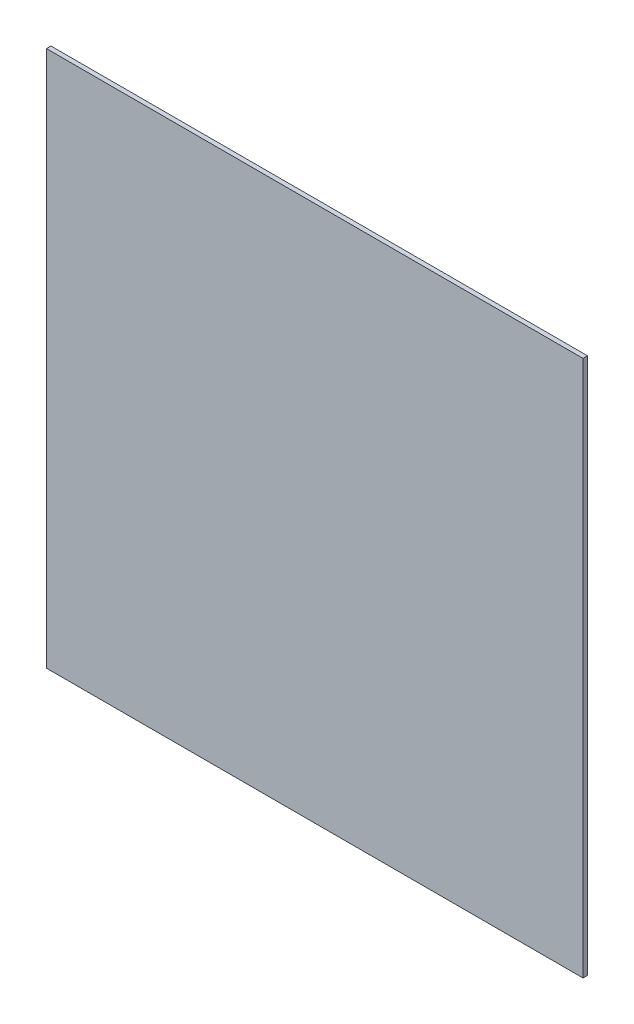
from build123d import *

# Parameters (mm, degrees)
CROQUIS1_W              = 119.38
CROQUIS1_H              = 119.38
SALIENTE_EXTRUIR1_DEPTH = 0.5


with BuildPart() as part:
    # Croquis1 → Saliente-Extruir1 (new, symmetric)
    with BuildSketch(Plane.XY):
        Rectangle(CROQUIS1_W, CROQUIS1_H)
    extrude(amount=SALIENTE_EXTRUIR1_DEPTH, both=True)


solid = part.part
